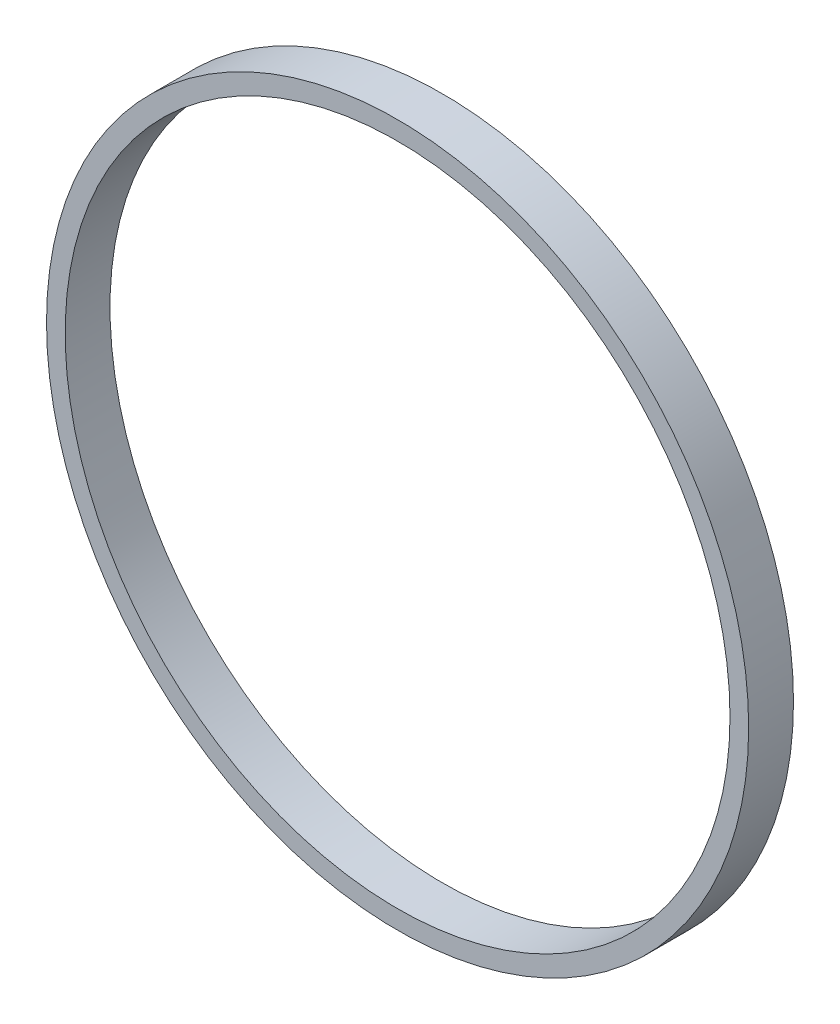
from build123d import *

# Parameters (mm, degrees)
SKETCH1_R           = 23.5
SKETCH1_R_2         = 22.25
BOSS_EXTRUDE1_DEPTH = 3


with BuildPart() as part:
    # Sketch1 → Boss-Extrude1 (new body)
    with BuildSketch(Plane.XY):
        Circle(SKETCH1_R)
        Circle(SKETCH1_R_2, mode=Mode.SUBTRACT)
    extrude(amount=BOSS_EXTRUDE1_DEPTH)


solid = part.part
